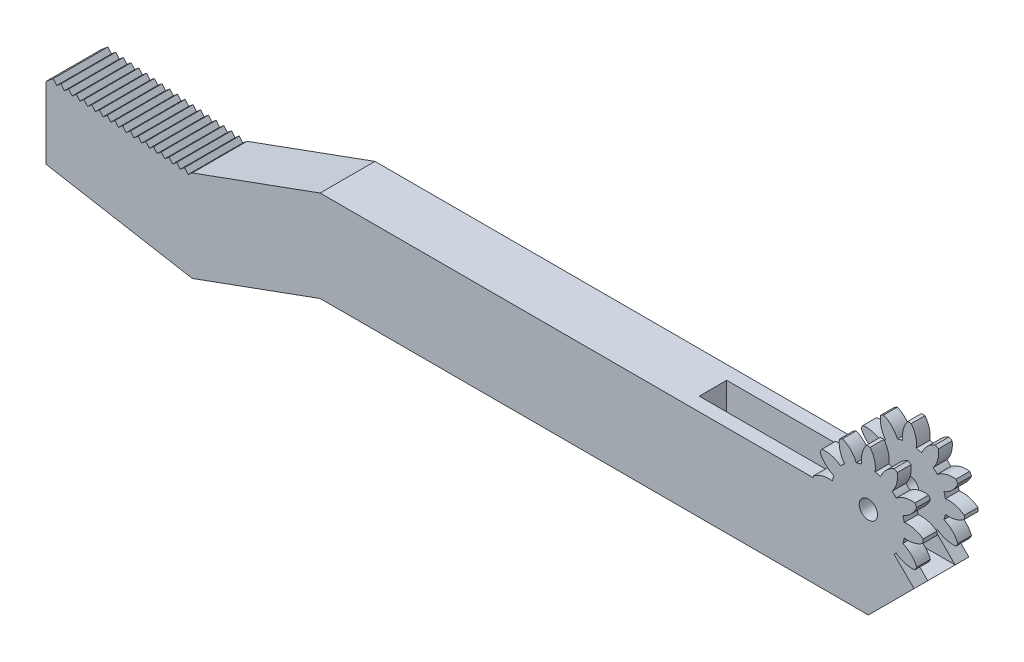
from build123d import *

# Parameters (mm, degrees)
BOSS_EXTRUDE1_DEPTH     = 30
BOSS_EXTRUDE2_DEPTH     = 30
CUT_EXTRUDE1_DEPTH      = 30
CUT_EXTRUDE3_DEPTH      = 43
CUT_EXTRUDE3_DEPTH_BACK = 100
SKETCH4_W               = 74
SKETCH4_H               = 15


with BuildPart() as part:
    # Sketch1 → Boss-Extrude1 (new body)
    with BuildSketch(Plane(origin=(0, 0, 0), x_dir=(0, 1, 0), z_dir=(0, 0, 1))):
        Polygon((0, 0), (0, 300), (-25.477916399, 370), (-27.406279228, 372.298133329), (-25.108145898, 374.226496158), (-27.036508727, 376.524629488), (-24.738375398, 378.452992317), (-26.666738227, 380.751125646), (-24.368604898, 382.679488475), (-26.296967727, 384.977621805), (-23.998834397, 386.905984634), (-25.927197227, 389.204117963), (-23.629063897, 391.132480792), (-25.557426726, 393.430614121), (-23.259293397, 395.35897695), (-25.187656226, 397.65711028), (-22.889522897, 399.585473109), (-24.817885726, 401.883606438), (-22.519752396, 403.811969267), (-24.448115225, 406.110102597), (-22.149981896, 408.038465426), (-24.078344725, 410.336598755), (-21.780211396, 412.264961584), (-23.708574225, 414.563094914), (-21.410440895, 416.491457743), (-23.338803724, 418.789591072), (-21.040670395, 420.717953901), (-22.969033224, 423.01608723), (-20.670899895, 424.944450059), (-22.599262724, 427.242583389), (-20.301129394, 429.170946218), (-22.229492224, 431.469079547), (-19.931358894, 433.397442376), (-21.859721723, 435.695575706), (-19.561588394, 437.623938535), (-21.489951223, 439.922071864), (-19.191817894, 441.850434693), (-21.120180723, 444.148568022), (-18.822047393, 446.076930851), (-22.113893269, 450), (-61.371757942, 450), (-75.477916399, 370), (-50, 300), (-50, 0), (-25, -25), align=None)
    extrude(amount=BOSS_EXTRUDE1_DEPTH)

    # Sketch3 → Boss-Extrude2 (add)
    with BuildSketch(Plane.XY.offset(30)):
        with BuildLine():
            Line((3.535533906, -3.535533906), (14.100912029, -14.100912029))
            Line((14.100912029, -14.100912029), (15.179930074, -13.021893985))
            ThreePointArc((15.179930074, -13.021893985), (20.03858246, -15.472056871), (25.466397806, -15.857571781))
            ThreePointArc((25.466397806, -15.857571781), (25.980762114, -15), (26.466258908, -14.125761553))
            ThreePointArc((26.466258908, -14.125761553), (23.418485529, -9.61789303), (18.867256033, -6.635258079))
            ThreePointArc((18.867256033, -6.635258079), (19.318516526, -5.176380902), (19.657152064, -3.68732596))
            ThreePointArc((19.657152064, -3.68732596), (25.089949902, -3.37990307), (29.983333333, -0.999861101))
            ThreePointArc((29.983333333, -0.999861101), (30, 0), (29.983333333, 0.999861101))
            ThreePointArc((29.983333333, 0.999861101), (25.089949902, 3.37990307), (19.657152064, 3.68732596))
            ThreePointArc((19.657152064, 3.68732596), (19.318516526, 5.176380902), (18.867256033, 6.635258079))
            ThreePointArc((18.867256033, 6.635258079), (23.418485529, 9.61789303), (26.466258908, 14.125761553))
            ThreePointArc((26.466258908, 14.125761553), (25.980762114, 15), (25.466397806, 15.857571781))
            ThreePointArc((25.466397806, 15.857571781), (20.03858246, 15.472056871), (15.179930074, 13.021893985))
            ThreePointArc((15.179930074, 13.021893985), (14.142135624, 14.142135624), (13.021893985, 15.179930074))
            ThreePointArc((13.021893985, 15.179930074), (15.472056871, 20.03858246), (15.857571781, 25.466397806))
            ThreePointArc((15.857571781, 25.466397806), (15, 25.980762114), (14.125761553, 26.466258908))
            ThreePointArc((14.125761553, 26.466258908), (9.61789303, 23.418485529), (6.635258079, 18.867256033))
            ThreePointArc((6.635258079, 18.867256033), (5.176380902, 19.318516526), (3.68732596, 19.657152064))
            ThreePointArc((3.68732596, 19.657152064), (3.37990307, 25.089949902), (0.999861101, 29.983333333))
            ThreePointArc((0.999861101, 29.983333333), (0, 30), (-0.999861101, 29.983333333))
            ThreePointArc((-0.999861101, 29.983333333), (-3.37990307, 25.089949902), (-3.68732596, 19.657152064))
            ThreePointArc((-3.68732596, 19.657152064), (-5.176380902, 19.318516526), (-6.635258079, 18.867256033))
            ThreePointArc((-6.635258079, 18.867256033), (-9.61789303, 23.418485529), (-14.125761553, 26.466258908))
            ThreePointArc((-14.125761553, 26.466258908), (-15, 25.980762114), (-15.857571781, 25.466397806))
            ThreePointArc((-15.857571781, 25.466397806), (-15.472056871, 20.03858246), (-13.021893985, 15.179930074))
            ThreePointArc((-13.021893985, 15.179930074), (-14.142135624, 14.142135624), (-15.179930074, 13.021893985))
            ThreePointArc((-15.179930074, 13.021893985), (-20.03858246, 15.472056871), (-25.466397806, 15.857571781))
            ThreePointArc((-25.466397806, 15.857571781), (-25.980762114, 15), (-26.466258908, 14.125761553))
            ThreePointArc((-26.466258908, 14.125761553), (-23.418485529, 9.61789303), (-18.867256033, 6.635258079))
            ThreePointArc((-18.867256033, 6.635258079), (-19.318516526, 5.176380902), (-19.657152064, 3.68732596))
            ThreePointArc((-19.657152064, 3.68732596), (-25.089949902, 3.37990307), (-29.983333333, 0.999861101))
            ThreePointArc((-29.983333333, 0.999861101), (-29.995833044, 0.5), (-30, 0))
            Line((-30, 0), (-5, 0))
            ThreePointArc((-5, 0), (-1.913417162, -4.619397663), (3.535533906, -3.535533906))
        make_face()
    extrude(amount=-BOSS_EXTRUDE2_DEPTH)

    # Sketch3<6> → Cut-Extrude1 (cut)
    with BuildSketch(Plane.XY.offset(30)):
        with BuildLine():
            Line((0, 0), (3.535533906, -3.535533906))
            ThreePointArc((3.535533906, -3.535533906), (4.619397663, -1.913417162), (5, 0))
            ThreePointArc((5, 0), (0, 5), (-5, 0))
            Line((-5, 0), (0, 0))
        make_face()
        with BuildLine():
            ThreePointArc((-5, 0), (-1.913417162, -4.619397663), (3.535533906, -3.535533906))
            Line((3.535533906, -3.535533906), (0, 0))
            Line((0, 0), (-5, 0))
        make_face()
    extrude(amount=-CUT_EXTRUDE1_DEPTH, mode=Mode.SUBTRACT)

    # Sketch4 → Cut-Extrude3 (cut, two sides: drawn at the far end of the back side and taken through both)
    with BuildSketch(Plane.YZ.offset(-CUT_EXTRUDE3_DEPTH_BACK)):
        with Locations((12, 15)):
            Rectangle(SKETCH4_W, SKETCH4_H)
    extrude(amount=CUT_EXTRUDE3_DEPTH + CUT_EXTRUDE3_DEPTH_BACK, mode=Mode.SUBTRACT)


solid = part.part
